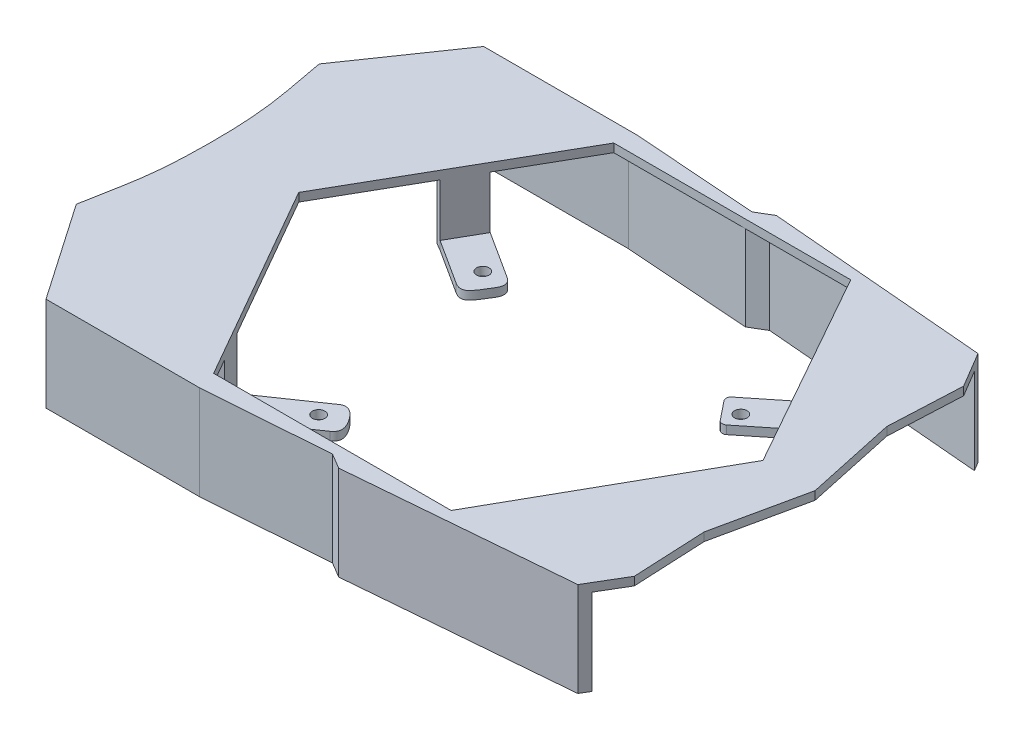
from build123d import *

# Parameters (mm, degrees)
SKETCH2_R             = 1.5
BOSS_EXTRUDE3_DEPTH   = 2
BOSS_EXTRUDE3_2_DEPTH = 2
BOSS_EXTRUDE3_3_DEPTH = 2
BOSS_EXTRUDE3_4_DEPTH = 2
BOSS_EXTRUDE7_DEPTH   = 14.5
BOSS_EXTRUDE8_DEPTH   = 2
BOSS_EXTRUDE9_DEPTH   = 20.5


with BuildPart() as part:
    # Sketch2 → Boss-Extrude3 (new body)
    with BuildSketch(Plane(origin=(0, 0, 0), x_dir=(1, 0, 0), z_dir=(0, 1, 0))):
        with BuildLine():
            Line((-43.230453913, 45.247658967), (-32.051235735, 38.062807212))
            add(Edge.make_bspline(
                [(-32.051235735, 38.062807212), (-29.653859452, 36.522020287), (-32.359204514, 33.058015897), (-34.393292894, 29.162596744), (-36.78390878, 30.699038781)],
                knots=[0, 0, 0, 0, 0.5, 1, 1, 1, 1], degree=3))
            Line((-36.78390878, 30.699038781), (-47.586935967, 37.642113656))
            Line((-47.586935967, 37.642113656), (-43.230453913, 45.247658967))
        make_face()
        with Locations(Location((-36.090252253, 36.336715974, 0), (0, 0, 270))):
            Circle(SKETCH2_R, mode=Mode.SUBTRACT)
    extrude(amount=BOSS_EXTRUDE3_DEPTH)



with BuildPart() as body_2:
    # Sketch2 → Boss-Extrude3 2 (new body)
    with BuildSketch(Plane(origin=(0, 0, 0), x_dir=(1, 0, 0), z_dir=(0, 1, 0))):
        with BuildLine():
            Line((-36.185423109, -25.10610692), (-21.279130416, -14.871322122))
            add(Edge.make_bspline(
                [(-25.795747584, -8.293165489), (-24.143697719, -7.158854283), (-21.111071083, -9.916279371), (-19.518538576, -13.662485091), (-21.279130416, -14.871322122)],
                knots=[0, 0, 0, 0, 0.5, 1, 1, 1, 1], degree=3))
            Line((-25.795747584, -8.293165489), (-40.164732197, -18.159030081))
            Line((-40.164732197, -18.159030081), (-36.185423109, -25.10610692))
        make_face()
        with Locations(Location((-26.079416612, -12.817810533, 0), (0, 0, 270))):
            Circle(SKETCH2_R, mode=Mode.SUBTRACT)
    extrude(amount=BOSS_EXTRUDE3_2_DEPTH)


with BuildPart() as body_3:
    # Sketch2 → Boss-Extrude3 3 (new body)
    with BuildSketch(Plane(origin=(0, 0, 0), x_dir=(1, 0, 0), z_dir=(0, 1, 0))):
        with BuildLine():
            Line((29.211666773, -22.314450198), (14.869230537, -14.260003913))
            ThreePointArc((14.869230537, -14.260003913), (14.264243858, -13.347032924), (14.652672015, -12.322997536))
            Line((14.652672015, -12.322997536), (19.160499642, -8.253264805))
            ThreePointArc((19.160499642, -8.253264805), (19.831311373, -7.951400174), (20.552224713, -8.097669073))
            Line((20.552224713, -8.097669073), (33.205147834, -15.203316117))
            Line((33.205147834, -15.203316117), (29.211666773, -22.314450198))
        make_face()
        with Locations(Location((19.995405598, -13.234640771, 0), (0, 0, 270))):
            Circle(SKETCH2_R, mode=Mode.SUBTRACT)
    extrude(amount=BOSS_EXTRUDE3_3_DEPTH)


with BuildPart() as body_4:
    # Sketch2 → Boss-Extrude3 4 (new body)
    with BuildSketch(Plane(origin=(0, 0, 0), x_dir=(1, 0, 0), z_dir=(0, 1, 0))):
        with BuildLine():
            Line((35.956282792, 42.745174925), (24.662993698, 33.699023938))
            ThreePointArc((24.662993698, 33.699023938), (23.78100089, 33.442857668), (22.976200889, 33.885383856))
            Line((22.976200889, 33.885383856), (19.347327143, 38.415699606))
            ThreePointArc((19.347327143, 38.415699606), (19.091160873, 39.297692414), (19.533687061, 40.102492416))
            Line((19.533687061, 40.102492416), (31.884499443, 49.995740759))
            Line((31.884499443, 49.995740759), (35.956282792, 42.745174925))
        make_face()
        with Locations(Location((24.166347117, 37.603010106, 0), (0, 0, 270))):
            Circle(SKETCH2_R, mode=Mode.SUBTRACT)
    extrude(amount=BOSS_EXTRUDE3_4_DEPTH)


with BuildPart() as part_1:
    add(part.part)

    add(body_2.part)  # Boss-Extrude7 merges body 2

    add(body_3.part)  # Boss-Extrude7 merges body 3

    add(body_4.part)  # Boss-Extrude7 merges body 4
    # Sketch7 → Boss-Extrude7 (add)
    with BuildSketch(Plane.XZ):
        Polygon((-36.185423109, 25.10610692), (-37.920880681, 26.100182881), (-41.900189769, 19.153106042), (-40.164732197, 18.159030081), align=None)
        Polygon((-43.230453913, -45.247658967), (-47.586935967, -37.642113656), (-49.322393538, -38.636189617), (-44.965911485, -46.241734929), align=None)
        Polygon((31.884499443, -49.995740759), (35.956282792, -42.745174925), (37.700117882, -43.724480381), (33.628334533, -50.975046216), align=None)
        Polygon((29.211666773, 22.314450198), (33.205147834, 15.203316117), (34.948982925, 16.182621573), (30.955501863, 23.293755654), align=None)
    extrude(amount=-BOSS_EXTRUDE7_DEPTH)

    # Sketch8 → Boss-Extrude8 (add)
    with BuildSketch(Plane(origin=(0, 14.5, 0), x_dir=(1, 0, 0), z_dir=(0, 1, 0))):
        with BuildLine():
            Line((-83.939033809, -12.743691802), (-67.948382544, -35.953321652))
            Line((-67.948382544, -35.953321652), (-31.333133825, -35.953321652))
            Line((-31.333133825, -35.953321652), (-1.800901789, -33.787598607))
            Line((-1.800901789, -33.787598607), (1.845003483, -35.953321652))
            Line((1.845003483, -35.953321652), (54.392894937, -31.485495915))
            Line((54.392894937, -31.485495915), (59.409090539, -23.040937859))
            Line((59.409090539, -23.040937859), (58.585665433, -5.537982821))
            Line((58.585665433, -5.537982821), (63.277626353, 16.220382558))
            Line((63.277626353, 16.220382558), (58.585665433, 37.978747936))
            Line((58.585665433, 37.978747936), (59.409090539, 55.481702974))
            Line((59.409090539, 55.481702974), (54.392894937, 63.926261031))
            Line((54.392894937, 63.926261031), (1.845003483, 68.394086768))
            Line((1.845003483, 68.394086768), (-1.800901789, 66.228363722))
            Line((-1.800901789, 66.228363722), (-31.333133825, 68.394086768))
            Line((-31.333133825, 68.394086768), (-67.948382544, 68.394086768))
            Line((-67.948382544, 68.394086768), (-83.939033809, 45.184456918))
            Line((-83.939033809, 45.184456918), (-82.229044773, 35.927906641))
            add(Edge.make_bspline(
                [(-82.229044773, 35.927906641), (-81.079922832, 29.707454467), (-80.671423408, 23.540442654), (-80.671423408, 17.253629197)],
                knots=[0, 0, 0, 0, 1, 1, 1, 1], degree=3))
            Line((-80.671423408, 17.253629197), (-80.671423408, 15.187135918))
            add(Edge.make_bspline(
                [(-82.229044773, -3.487141526), (-81.079922832, 2.733310648), (-80.671423408, 8.900322461), (-80.671423408, 15.187135918)],
                knots=[0, 0, 0, 0, 1, 1, 1, 1], degree=3))
            Line((-82.229044773, -3.487141526), (-83.939033809, -12.743691802))
        make_face()
        Polygon((-59.857375923, 16.220382558), (-40.164732197, -18.159030081), (-32.644643784, -31.287598607), (23.993388186, -31.287598607), (50.833438729, 16.220382558), (23.99393098, 63.976016309), (-32.502787546, 63.976016309), align=None, mode=Mode.SUBTRACT)
    extrude(amount=BOSS_EXTRUDE8_DEPTH)

    # Sketch9 → Boss-Extrude9 (add)
    with BuildSketch(Plane.XZ.offset(-14.5)):
        Polygon((-67.948382544, -66.394086768), (-69.326315011, -66.394086768), (-67.948382544, -68.394086768), (-31.333133825, -68.394086768), (-1.800901789, -66.228363722), (1.845003483, -68.394086768), (54.392894937, -63.926261031), (55.648633387, -61.81227723), (54.223458503, -61.933451132), (2.314827743, -66.346924443), (-1.320082635, -64.187732531), (-31.406369708, -66.394086768), align=None)
        Polygon((-67.948382544, 33.953321652), (-69.326315011, 33.953321652), (-67.948382544, 35.953321652), (-31.333133825, 35.953321652), (-1.800901789, 33.787598607), (1.845003483, 35.953321652), (54.392894937, 31.485495915), (55.648633387, 29.371512115), (54.223458503, 29.492686016), (2.314827743, 33.906159327), (-1.320082635, 31.746967416), (-31.406369708, 33.953321652), align=None)
    extrude(amount=BOSS_EXTRUDE9_DEPTH)


solid = part_1.part
